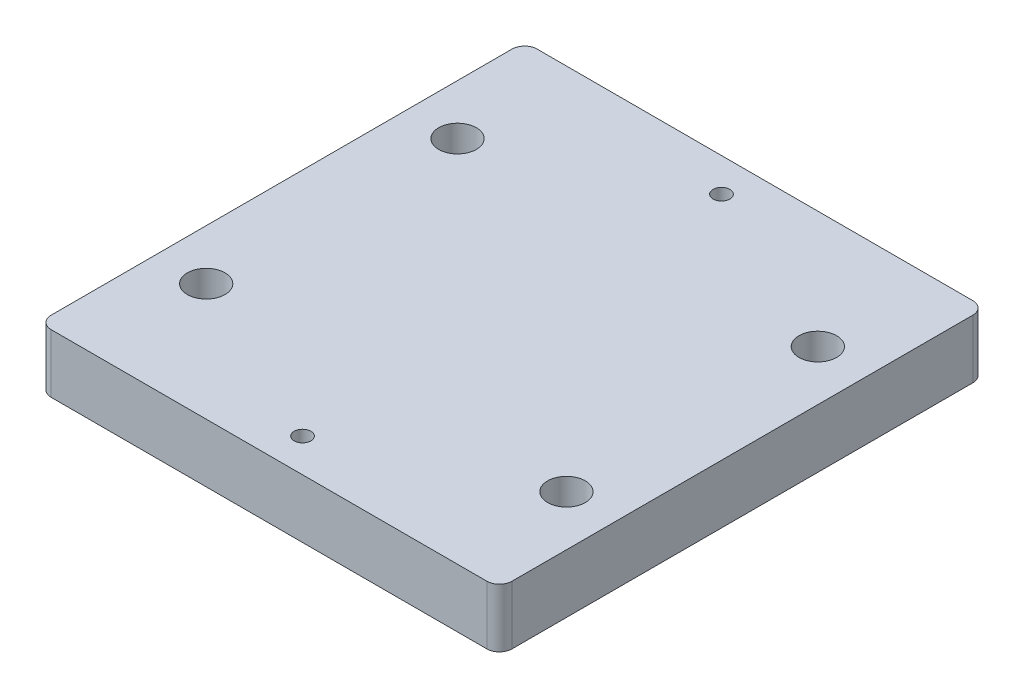
from build123d import *

# Parameters (mm, degrees)
SKETCH_1_W      = 110
SKETCH_1_H      = 116
SKETCH_1_R      = 4.5
SKETCH_1_R_2    = 2
EXTRUDE_1_DEPTH = 14
FILLET_1_R      = 3


with BuildPart() as part:
    # 草图1 → 凸台-拉伸1 (new body)
    with BuildSketch(Plane(origin=(0, 0, 0), x_dir=(1, 0, 0), z_dir=(0, 1, 0))):
        Rectangle(SKETCH_1_W, SKETCH_1_H)
        with Locations(Location((-43, 30, 0), (0, 0, 270))):
            Circle(SKETCH_1_R, mode=Mode.SUBTRACT)
        with Locations(Location((43, 30, 0), (0, 0, 270))):
            Circle(SKETCH_1_R, mode=Mode.SUBTRACT)
        with Locations(Location((43, -30, 0), (0, 0, 270))):
            Circle(SKETCH_1_R, mode=Mode.SUBTRACT)
        with Locations(Location((-43, -30, 0), (0, 0, 270))):
            Circle(SKETCH_1_R, mode=Mode.SUBTRACT)
        with Locations(Location((0, -50, 0), (0, 0, 270))):
            Circle(SKETCH_1_R_2, mode=Mode.SUBTRACT)
        with Locations(Location((0, 50, 0), (0, 0, 90))):
            Circle(SKETCH_1_R_2, mode=Mode.SUBTRACT)
    extrude(amount=EXTRUDE_1_DEPTH)

    # 圆角1
    fillet_1_edges = [part.edges().sort_by_distance(p)[0] for p in [
        (-55, 7, -58),
        (55, 7, -58),
        (55, 7, 58),
        (-55, 7, 58),
    ]]
    fillet(fillet_1_edges, radius=FILLET_1_R)


solid = part.part
